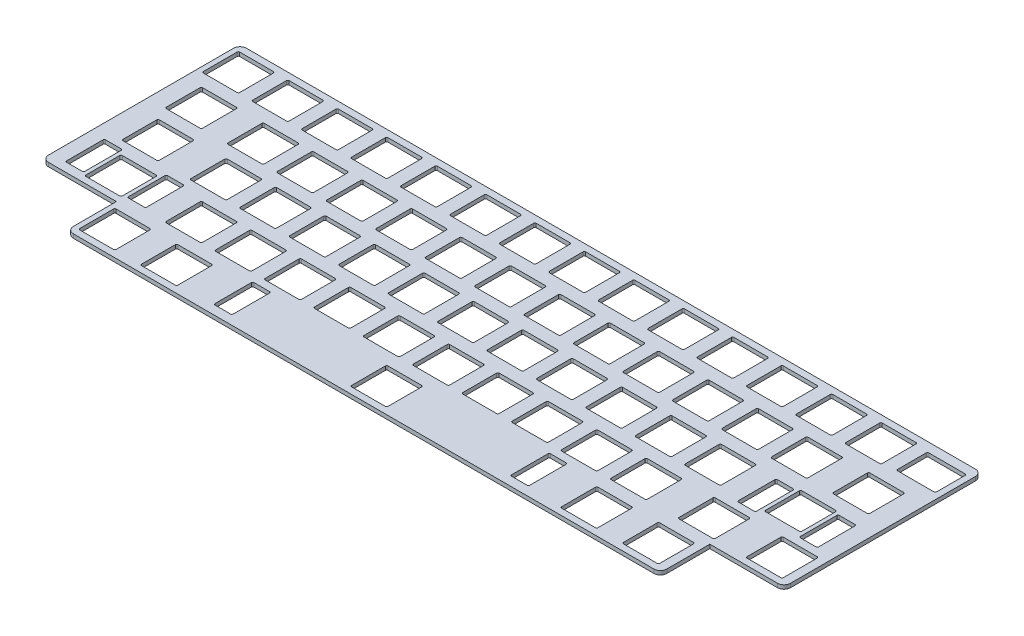
from build123d import *

# Parameters (mm, degrees)
BOSS_EXTRUDE1_DEPTH = 1.5
FILLET1_R           = 2.5


with BuildPart() as part:
    # Sketch1 → Boss-Extrude1 (new body)
    with BuildSketch(Plane(origin=(0, 0, 0), x_dir=(1, 0, 0), z_dir=(0, 1, 0))):
        Polygon((0.569553771, 0.054339834), (286.319553771, 0.054339834), (286.319553771, -76.145660166), (257.744553771, -76.145660166), (257.744553771, -95.195660166), (29.144553771, -95.195660166), (29.144553771, -76.145660166), (0.569553771, -76.145660166), align=None)
        with BuildLine():
            Line((3.023274247, -2.523559495), (16.015857787, -2.523559495))
            ThreePointArc((16.015857787, -2.523559495), (16.369209476, -2.669922557), (16.515572538, -3.023274247))
            Line((16.515572538, -3.023274247), (16.515572538, -16.015857787))
            ThreePointArc((16.515572538, -16.015857787), (16.369209476, -16.369209476), (16.015857787, -16.515572538))
            Line((16.015857787, -16.515572538), (3.023274247, -16.515572538))
            ThreePointArc((3.023274247, -16.515572538), (2.669922557, -16.369209476), (2.523559495, -16.015857787))
            Line((2.523559495, -16.015857787), (2.523559495, -3.023274247))
            ThreePointArc((2.523559495, -3.023274247), (2.669922557, -2.669922557), (3.023274247, -2.523559495))
        make_face(mode=Mode.SUBTRACT)
        with BuildLine():
            Line((22.06240628, -2.523559495), (35.05498982, -2.523559495))
            ThreePointArc((35.05498982, -2.523559495), (35.408341509, -2.669922557), (35.554704571, -3.023274247))
            Line((35.554704571, -3.023274247), (35.554704571, -16.015857787))
            ThreePointArc((35.554704571, -16.015857787), (35.408341509, -16.369209476), (35.05498982, -16.515572538))
            Line((35.05498982, -16.515572538), (22.06240628, -16.515572538))
            ThreePointArc((22.06240628, -16.515572538), (21.709054591, -16.369209476), (21.562691529, -16.015857787))
            Line((21.562691529, -16.015857787), (21.562691529, -3.023274247))
            ThreePointArc((21.562691529, -3.023274247), (21.709054591, -2.669922557), (22.06240628, -2.523559495))
        make_face(mode=Mode.SUBTRACT)
        with BuildLine():
            Line((41.101538313, -2.523559495), (54.094121853, -2.523559495))
            ThreePointArc((54.094121853, -2.523559495), (54.447473543, -2.669922557), (54.593836605, -3.023274247))
            Line((54.593836605, -3.023274247), (54.593836605, -16.015857787))
            ThreePointArc((54.593836605, -16.015857787), (54.447473543, -16.369209476), (54.094121853, -16.515572538))
            Line((54.094121853, -16.515572538), (41.101538313, -16.515572538))
            ThreePointArc((41.101538313, -16.515572538), (40.748186624, -16.369209476), (40.601823562, -16.015857787))
            Line((40.601823562, -16.015857787), (40.601823562, -3.023274247))
            ThreePointArc((40.601823562, -3.023274247), (40.748186624, -2.669922557), (41.101538313, -2.523559495))
        make_face(mode=Mode.SUBTRACT)
        with BuildLine():
            Line((60.140670347, -2.523559495), (73.133253886, -2.523559495))
            ThreePointArc((73.133253886, -2.523559495), (73.486605576, -2.669922557), (73.632968638, -3.023274247))
            Line((73.632968638, -3.023274247), (73.632968638, -16.015857787))
            ThreePointArc((73.632968638, -16.015857787), (73.486605576, -16.369209476), (73.133253886, -16.515572538))
            Line((73.133253886, -16.515572538), (60.140670347, -16.515572538))
            ThreePointArc((60.140670347, -16.515572538), (59.787318657, -16.369209476), (59.640955595, -16.015857787))
            Line((59.640955595, -16.015857787), (59.640955595, -3.023274247))
            ThreePointArc((59.640955595, -3.023274247), (59.787318657, -2.669922557), (60.140670347, -2.523559495))
        make_face(mode=Mode.SUBTRACT)
        with BuildLine():
            Line((79.17980238, -2.523559495), (92.17238592, -2.523559495))
            ThreePointArc((92.17238592, -2.523559495), (92.525737609, -2.669922557), (92.672100671, -3.023274247))
            Line((92.672100671, -3.023274247), (92.672100671, -16.015857787))
            ThreePointArc((92.672100671, -16.015857787), (92.525737609, -16.369209476), (92.17238592, -16.515572538))
            Line((92.17238592, -16.515572538), (79.17980238, -16.515572538))
            ThreePointArc((79.17980238, -16.515572538), (78.82645069, -16.369209476), (78.680087628, -16.015857787))
            Line((78.680087628, -16.015857787), (78.680087628, -3.023274247))
            ThreePointArc((78.680087628, -3.023274247), (78.82645069, -2.669922557), (79.17980238, -2.523559495))
        make_face(mode=Mode.SUBTRACT)
        with BuildLine():
            Line((98.218934413, -2.523559495), (111.211517953, -2.523559495))
            ThreePointArc((111.211517953, -2.523559495), (111.564869642, -2.669922557), (111.711232704, -3.023274247))
            Line((111.711232704, -3.023274247), (111.711232704, -16.015857787))
            ThreePointArc((111.711232704, -16.015857787), (111.564869642, -16.369209476), (111.211517953, -16.515572538))
            Line((111.211517953, -16.515572538), (98.218934413, -16.515572538))
            ThreePointArc((98.218934413, -16.515572538), (97.865582724, -16.369209476), (97.719219662, -16.015857787))
            Line((97.719219662, -16.015857787), (97.719219662, -3.023274247))
            ThreePointArc((97.719219662, -3.023274247), (97.865582724, -2.669922557), (98.218934413, -2.523559495))
        make_face(mode=Mode.SUBTRACT)
        with BuildLine():
            Line((117.258066446, -2.523559495), (130.250649986, -2.523559495))
            ThreePointArc((130.250649986, -2.523559495), (130.604001676, -2.669922557), (130.750364738, -3.023274247))
            Line((130.750364738, -3.023274247), (130.750364738, -16.015857787))
            ThreePointArc((130.750364738, -16.015857787), (130.604001676, -16.369209476), (130.250649986, -16.515572538))
            Line((130.250649986, -16.515572538), (117.258066446, -16.515572538))
            ThreePointArc((117.258066446, -16.515572538), (116.904714757, -16.369209476), (116.758351695, -16.015857787))
            Line((116.758351695, -16.015857787), (116.758351695, -3.023274247))
            ThreePointArc((116.758351695, -3.023274247), (116.904714757, -2.669922557), (117.258066446, -2.523559495))
        make_face(mode=Mode.SUBTRACT)
        with BuildLine():
            Line((136.29719848, -2.523559495), (149.28978202, -2.523559495))
            ThreePointArc((149.28978202, -2.523559495), (149.643133709, -2.669922557), (149.789496771, -3.023274247))
            Line((149.789496771, -3.023274247), (149.789496771, -16.015857787))
            ThreePointArc((149.789496771, -16.015857787), (149.643133709, -16.369209476), (149.28978202, -16.515572538))
            Line((149.28978202, -16.515572538), (136.29719848, -16.515572538))
            ThreePointArc((136.29719848, -16.515572538), (135.94384679, -16.369209476), (135.797483728, -16.015857787))
            Line((135.797483728, -16.015857787), (135.797483728, -3.023274247))
            ThreePointArc((135.797483728, -3.023274247), (135.94384679, -2.669922557), (136.29719848, -2.523559495))
        make_face(mode=Mode.SUBTRACT)
        with BuildLine():
            Line((155.336330513, -2.523559495), (168.328914053, -2.523559495))
            ThreePointArc((168.328914053, -2.523559495), (168.682265742, -2.669922557), (168.828628804, -3.023274247))
            Line((168.828628804, -3.023274247), (168.828628804, -16.015857787))
            ThreePointArc((168.828628804, -16.015857787), (168.682265742, -16.369209476), (168.328914053, -16.515572538))
            Line((168.328914053, -16.515572538), (155.336330513, -16.515572538))
            ThreePointArc((155.336330513, -16.515572538), (154.982978824, -16.369209476), (154.836615762, -16.015857787))
            Line((154.836615762, -16.015857787), (154.836615762, -3.023274247))
            ThreePointArc((154.836615762, -3.023274247), (154.982978824, -2.669922557), (155.336330513, -2.523559495))
        make_face(mode=Mode.SUBTRACT)
        with BuildLine():
            Line((174.375462546, -2.523559495), (187.368046086, -2.523559495))
            ThreePointArc((187.368046086, -2.523559495), (187.721397776, -2.669922557), (187.867760838, -3.023274247))
            Line((187.867760838, -3.023274247), (187.867760838, -16.015857787))
            ThreePointArc((187.867760838, -16.015857787), (187.721397776, -16.369209476), (187.368046086, -16.515572538))
            Line((187.368046086, -16.515572538), (174.375462546, -16.515572538))
            ThreePointArc((174.375462546, -16.515572538), (174.022110857, -16.369209476), (173.875747795, -16.015857787))
            Line((173.875747795, -16.015857787), (173.875747795, -3.023274247))
            ThreePointArc((173.875747795, -3.023274247), (174.022110857, -2.669922557), (174.375462546, -2.523559495))
        make_face(mode=Mode.SUBTRACT)
        with BuildLine():
            Line((193.41459458, -2.523559495), (206.407178119, -2.523559495))
            ThreePointArc((206.407178119, -2.523559495), (206.760529809, -2.669922557), (206.906892871, -3.023274247))
            Line((206.906892871, -3.023274247), (206.906892871, -16.015857787))
            ThreePointArc((206.906892871, -16.015857787), (206.760529809, -16.369209476), (206.407178119, -16.515572538))
            Line((206.407178119, -16.515572538), (193.41459458, -16.515572538))
            ThreePointArc((193.41459458, -16.515572538), (193.06124289, -16.369209476), (192.914879828, -16.015857787))
            Line((192.914879828, -16.015857787), (192.914879828, -3.023274247))
            ThreePointArc((192.914879828, -3.023274247), (193.06124289, -2.669922557), (193.41459458, -2.523559495))
        make_face(mode=Mode.SUBTRACT)
        with BuildLine():
            Line((212.453726613, -2.523559495), (225.446310153, -2.523559495))
            ThreePointArc((225.446310153, -2.523559495), (225.799661842, -2.669922557), (225.946024904, -3.023274247))
            Line((225.946024904, -3.023274247), (225.946024904, -16.015857787))
            ThreePointArc((225.946024904, -16.015857787), (225.799661842, -16.369209476), (225.446310153, -16.515572538))
            Line((225.446310153, -16.515572538), (212.453726613, -16.515572538))
            ThreePointArc((212.453726613, -16.515572538), (212.100374923, -16.369209476), (211.954011861, -16.015857787))
            Line((211.954011861, -16.015857787), (211.954011861, -3.023274247))
            ThreePointArc((211.954011861, -3.023274247), (212.100374923, -2.669922557), (212.453726613, -2.523559495))
        make_face(mode=Mode.SUBTRACT)
        with BuildLine():
            Line((231.492858646, -2.523559495), (244.485442186, -2.523559495))
            ThreePointArc((244.485442186, -2.523559495), (244.838793875, -2.669922557), (244.985156937, -3.023274247))
            Line((244.985156937, -3.023274247), (244.985156937, -16.015857787))
            ThreePointArc((244.985156937, -16.015857787), (244.838793875, -16.369209476), (244.485442186, -16.515572538))
            Line((244.485442186, -16.515572538), (231.492858646, -16.515572538))
            ThreePointArc((231.492858646, -16.515572538), (231.139506957, -16.369209476), (230.993143895, -16.015857787))
            Line((230.993143895, -16.015857787), (230.993143895, -3.023274247))
            ThreePointArc((230.993143895, -3.023274247), (231.139506957, -2.669922557), (231.492858646, -2.523559495))
        make_face(mode=Mode.SUBTRACT)
        with BuildLine():
            Line((250.531990679, -2.523559495), (263.524574219, -2.523559495))
            ThreePointArc((263.524574219, -2.523559495), (263.877925909, -2.669922557), (264.024288971, -3.023274247))
            Line((264.024288971, -3.023274247), (264.024288971, -16.015857787))
            ThreePointArc((264.024288971, -16.015857787), (263.877925909, -16.369209476), (263.524574219, -16.515572538))
            Line((263.524574219, -16.515572538), (250.531990679, -16.515572538))
            ThreePointArc((250.531990679, -16.515572538), (250.17863899, -16.369209476), (250.032275928, -16.015857787))
            Line((250.032275928, -16.015857787), (250.032275928, -3.023274247))
            ThreePointArc((250.032275928, -3.023274247), (250.17863899, -2.669922557), (250.531990679, -2.523559495))
        make_face(mode=Mode.SUBTRACT)
        with BuildLine():
            Line((7.783057255, -21.562691529), (20.775640795, -21.562691529))
            ThreePointArc((20.775640795, -21.562691529), (21.128992484, -21.709054591), (21.275355546, -22.06240628))
            Line((21.275355546, -22.06240628), (21.275355546, -35.05498982))
            ThreePointArc((21.275355546, -35.05498982), (21.128992484, -35.408341509), (20.775640795, -35.554704571))
            Line((20.775640795, -35.554704571), (7.783057255, -35.554704571))
            ThreePointArc((7.783057255, -35.554704571), (7.429705566, -35.408341509), (7.283342504, -35.05498982))
            Line((7.283342504, -35.05498982), (7.283342504, -22.06240628))
            ThreePointArc((7.283342504, -22.06240628), (7.429705566, -21.709054591), (7.783057255, -21.562691529))
        make_face(mode=Mode.SUBTRACT)
        with BuildLine():
            Line((31.581972297, -21.562691529), (44.574555836, -21.562691529))
            ThreePointArc((44.574555836, -21.562691529), (44.927907526, -21.709054591), (45.074270588, -22.06240628))
            Line((45.074270588, -22.06240628), (45.074270588, -35.05498982))
            ThreePointArc((45.074270588, -35.05498982), (44.927907526, -35.408341509), (44.574555836, -35.554704571))
            Line((44.574555836, -35.554704571), (31.581972297, -35.554704571))
            ThreePointArc((31.581972297, -35.554704571), (31.228620607, -35.408341509), (31.082257545, -35.05498982))
            Line((31.082257545, -35.05498982), (31.082257545, -22.06240628))
            ThreePointArc((31.082257545, -22.06240628), (31.228620607, -21.709054591), (31.581972297, -21.562691529))
        make_face(mode=Mode.SUBTRACT)
        with BuildLine():
            Line((50.62110433, -21.562691529), (63.61368787, -21.562691529))
            ThreePointArc((63.61368787, -21.562691529), (63.967039559, -21.709054591), (64.113402621, -22.06240628))
            Line((64.113402621, -22.06240628), (64.113402621, -35.05498982))
            ThreePointArc((64.113402621, -35.05498982), (63.967039559, -35.408341509), (63.61368787, -35.554704571))
            Line((63.61368787, -35.554704571), (50.62110433, -35.554704571))
            ThreePointArc((50.62110433, -35.554704571), (50.267752641, -35.408341509), (50.121389578, -35.05498982))
            Line((50.121389578, -35.05498982), (50.121389578, -22.06240628))
            ThreePointArc((50.121389578, -22.06240628), (50.267752641, -21.709054591), (50.62110433, -21.562691529))
        make_face(mode=Mode.SUBTRACT)
        with BuildLine():
            Line((69.660236363, -21.562691529), (82.652819903, -21.562691529))
            ThreePointArc((82.652819903, -21.562691529), (83.006171592, -21.709054591), (83.152534655, -22.06240628))
            Line((83.152534655, -22.06240628), (83.152534655, -35.05498982))
            ThreePointArc((83.152534655, -35.05498982), (83.006171592, -35.408341509), (82.652819903, -35.554704571))
            Line((82.652819903, -35.554704571), (69.660236363, -35.554704571))
            ThreePointArc((69.660236363, -35.554704571), (69.306884674, -35.408341509), (69.160521612, -35.05498982))
            Line((69.160521612, -35.05498982), (69.160521612, -22.06240628))
            ThreePointArc((69.160521612, -22.06240628), (69.306884674, -21.709054591), (69.660236363, -21.562691529))
        make_face(mode=Mode.SUBTRACT)
        with BuildLine():
            Line((88.699368397, -21.562691529), (101.691951936, -21.562691529))
            ThreePointArc((101.691951936, -21.562691529), (102.045303626, -21.709054591), (102.191666688, -22.06240628))
            Line((102.191666688, -22.06240628), (102.191666688, -35.05498982))
            ThreePointArc((102.191666688, -35.05498982), (102.045303626, -35.408341509), (101.691951936, -35.554704571))
            Line((101.691951936, -35.554704571), (88.699368397, -35.554704571))
            ThreePointArc((88.699368397, -35.554704571), (88.346016707, -35.408341509), (88.199653645, -35.05498982))
            Line((88.199653645, -35.05498982), (88.199653645, -22.06240628))
            ThreePointArc((88.199653645, -22.06240628), (88.346016707, -21.709054591), (88.699368397, -21.562691529))
        make_face(mode=Mode.SUBTRACT)
        with BuildLine():
            Line((107.73850043, -21.562691529), (120.73108397, -21.562691529))
            ThreePointArc((120.73108397, -21.562691529), (121.084435659, -21.709054591), (121.230798721, -22.06240628))
            Line((121.230798721, -22.06240628), (121.230798721, -35.05498982))
            ThreePointArc((121.230798721, -35.05498982), (121.084435659, -35.408341509), (120.73108397, -35.554704571))
            Line((120.73108397, -35.554704571), (107.73850043, -35.554704571))
            ThreePointArc((107.73850043, -35.554704571), (107.38514874, -35.408341509), (107.238785678, -35.05498982))
            Line((107.238785678, -35.05498982), (107.238785678, -22.06240628))
            ThreePointArc((107.238785678, -22.06240628), (107.38514874, -21.709054591), (107.73850043, -21.562691529))
        make_face(mode=Mode.SUBTRACT)
        with BuildLine():
            Line((126.777632463, -21.562691529), (139.770216003, -21.562691529))
            ThreePointArc((139.770216003, -21.562691529), (140.123567692, -21.709054591), (140.269930754, -22.06240628))
            Line((140.269930754, -22.06240628), (140.269930754, -35.05498982))
            ThreePointArc((140.269930754, -35.05498982), (140.123567692, -35.408341509), (139.770216003, -35.554704571))
            Line((139.770216003, -35.554704571), (126.777632463, -35.554704571))
            ThreePointArc((126.777632463, -35.554704571), (126.424280774, -35.408341509), (126.277917712, -35.05498982))
            Line((126.277917712, -35.05498982), (126.277917712, -22.06240628))
            ThreePointArc((126.277917712, -22.06240628), (126.424280774, -21.709054591), (126.777632463, -21.562691529))
        make_face(mode=Mode.SUBTRACT)
        with BuildLine():
            Line((145.816764496, -21.562691529), (158.809348036, -21.562691529))
            ThreePointArc((158.809348036, -21.562691529), (159.162699726, -21.709054591), (159.309062788, -22.06240628))
            Line((159.309062788, -22.06240628), (159.309062788, -35.05498982))
            ThreePointArc((159.309062788, -35.05498982), (159.162699726, -35.408341509), (158.809348036, -35.554704571))
            Line((158.809348036, -35.554704571), (145.816764496, -35.554704571))
            ThreePointArc((145.816764496, -35.554704571), (145.463412807, -35.408341509), (145.317049745, -35.05498982))
            Line((145.317049745, -35.05498982), (145.317049745, -22.06240628))
            ThreePointArc((145.317049745, -22.06240628), (145.463412807, -21.709054591), (145.816764496, -21.562691529))
        make_face(mode=Mode.SUBTRACT)
        with BuildLine():
            Line((164.85589653, -21.562691529), (177.848480069, -21.562691529))
            ThreePointArc((177.848480069, -21.562691529), (178.201831759, -21.709054591), (178.348194821, -22.06240628))
            Line((178.348194821, -22.06240628), (178.348194821, -35.05498982))
            ThreePointArc((178.348194821, -35.05498982), (178.201831759, -35.408341509), (177.848480069, -35.554704571))
            Line((177.848480069, -35.554704571), (164.85589653, -35.554704571))
            ThreePointArc((164.85589653, -35.554704571), (164.50254484, -35.408341509), (164.356181778, -35.05498982))
            Line((164.356181778, -35.05498982), (164.356181778, -22.06240628))
            ThreePointArc((164.356181778, -22.06240628), (164.50254484, -21.709054591), (164.85589653, -21.562691529))
        make_face(mode=Mode.SUBTRACT)
        with BuildLine():
            Line((183.895028563, -21.562691529), (196.887612103, -21.562691529))
            ThreePointArc((196.887612103, -21.562691529), (197.240963792, -21.709054591), (197.387326854, -22.06240628))
            Line((197.387326854, -22.06240628), (197.387326854, -35.05498982))
            ThreePointArc((197.387326854, -35.05498982), (197.240963792, -35.408341509), (196.887612103, -35.554704571))
            Line((196.887612103, -35.554704571), (183.895028563, -35.554704571))
            ThreePointArc((183.895028563, -35.554704571), (183.541676874, -35.408341509), (183.395313811, -35.05498982))
            Line((183.395313811, -35.05498982), (183.395313811, -22.06240628))
            ThreePointArc((183.395313811, -22.06240628), (183.541676874, -21.709054591), (183.895028563, -21.562691529))
        make_face(mode=Mode.SUBTRACT)
        with BuildLine():
            Line((202.934160596, -21.562691529), (215.926744136, -21.562691529))
            ThreePointArc((215.926744136, -21.562691529), (216.280095825, -21.709054591), (216.426458888, -22.06240628))
            Line((216.426458888, -22.06240628), (216.426458888, -35.05498982))
            ThreePointArc((216.426458888, -35.05498982), (216.280095825, -35.408341509), (215.926744136, -35.554704571))
            Line((215.926744136, -35.554704571), (202.934160596, -35.554704571))
            ThreePointArc((202.934160596, -35.554704571), (202.580808907, -35.408341509), (202.434445845, -35.05498982))
            Line((202.434445845, -35.05498982), (202.434445845, -22.06240628))
            ThreePointArc((202.434445845, -22.06240628), (202.580808907, -21.709054591), (202.934160596, -21.562691529))
        make_face(mode=Mode.SUBTRACT)
        with BuildLine():
            Line((221.97329263, -21.562691529), (234.965876169, -21.562691529))
            ThreePointArc((234.965876169, -21.562691529), (235.319227859, -21.709054591), (235.465590921, -22.06240628))
            Line((235.465590921, -22.06240628), (235.465590921, -35.05498982))
            ThreePointArc((235.465590921, -35.05498982), (235.319227859, -35.408341509), (234.965876169, -35.554704571))
            Line((234.965876169, -35.554704571), (221.97329263, -35.554704571))
            ThreePointArc((221.97329263, -35.554704571), (221.61994094, -35.408341509), (221.473577878, -35.05498982))
            Line((221.473577878, -35.05498982), (221.473577878, -22.06240628))
            ThreePointArc((221.473577878, -22.06240628), (221.61994094, -21.709054591), (221.97329263, -21.562691529))
        make_face(mode=Mode.SUBTRACT)
        with BuildLine():
            Line((241.012424663, -21.562691529), (254.005008203, -21.562691529))
            ThreePointArc((254.005008203, -21.562691529), (254.358359892, -21.709054591), (254.504722954, -22.06240628))
            Line((254.504722954, -22.06240628), (254.504722954, -35.05498982))
            ThreePointArc((254.504722954, -35.05498982), (254.358359892, -35.408341509), (254.005008203, -35.554704571))
            Line((254.005008203, -35.554704571), (241.012424663, -35.554704571))
            ThreePointArc((241.012424663, -35.554704571), (240.659072973, -35.408341509), (240.512709911, -35.05498982))
            Line((240.512709911, -35.05498982), (240.512709911, -22.06240628))
            ThreePointArc((240.512709911, -22.06240628), (240.659072973, -21.709054591), (241.012424663, -21.562691529))
        make_face(mode=Mode.SUBTRACT)
        with BuildLine():
            Line((264.811339704, -21.562691529), (277.803923244, -21.562691529))
            ThreePointArc((277.803923244, -21.562691529), (278.157274934, -21.709054591), (278.303637996, -22.06240628))
            Line((278.303637996, -22.06240628), (278.303637996, -35.05498982))
            ThreePointArc((278.303637996, -35.05498982), (278.157274934, -35.408341509), (277.803923244, -35.554704571))
            Line((277.803923244, -35.554704571), (264.811339704, -35.554704571))
            ThreePointArc((264.811339704, -35.554704571), (264.457988015, -35.408341509), (264.311624953, -35.05498982))
            Line((264.311624953, -35.05498982), (264.311624953, -22.06240628))
            ThreePointArc((264.311624953, -22.06240628), (264.457988015, -21.709054591), (264.811339704, -21.562691529))
        make_face(mode=Mode.SUBTRACT)
        with BuildLine():
            Line((10.162948759, -40.601823562), (23.155532299, -40.601823562))
            ThreePointArc((23.155532299, -40.601823562), (23.508883988, -40.748186624), (23.655247051, -41.101538313))
            Line((23.655247051, -41.101538313), (23.655247051, -54.094121853))
            ThreePointArc((23.655247051, -54.094121853), (23.508883988, -54.447473543), (23.155532299, -54.593836605))
            Line((23.155532299, -54.593836605), (10.162948759, -54.593836605))
            ThreePointArc((10.162948759, -54.593836605), (9.80959707, -54.447473543), (9.663234008, -54.094121853))
            Line((9.663234008, -54.094121853), (9.663234008, -41.101538313))
            ThreePointArc((9.663234008, -41.101538313), (9.80959707, -40.748186624), (10.162948759, -40.601823562))
        make_face(mode=Mode.SUBTRACT)
        with BuildLine():
            Line((36.341755305, -40.601823562), (49.334338845, -40.601823562))
            ThreePointArc((49.334338845, -40.601823562), (49.687690534, -40.748186624), (49.834053596, -41.101538313))
            Line((49.834053596, -41.101538313), (49.834053596, -54.094121853))
            ThreePointArc((49.834053596, -54.094121853), (49.687690534, -54.447473543), (49.334338845, -54.593836605))
            Line((49.334338845, -54.593836605), (36.341755305, -54.593836605))
            ThreePointArc((36.341755305, -54.593836605), (35.988403616, -54.447473543), (35.842040553, -54.094121853))
            Line((35.842040553, -54.094121853), (35.842040553, -41.101538313))
            ThreePointArc((35.842040553, -41.101538313), (35.988403616, -40.748186624), (36.341755305, -40.601823562))
        make_face(mode=Mode.SUBTRACT)
        with BuildLine():
            Line((55.380887338, -40.601823562), (68.373470878, -40.601823562))
            ThreePointArc((68.373470878, -40.601823562), (68.726822568, -40.748186624), (68.87318563, -41.101538313))
            Line((68.87318563, -41.101538313), (68.87318563, -54.094121853))
            ThreePointArc((68.87318563, -54.094121853), (68.726822568, -54.447473543), (68.373470878, -54.593836605))
            Line((68.373470878, -54.593836605), (55.380887338, -54.593836605))
            ThreePointArc((55.380887338, -54.593836605), (55.027535649, -54.447473543), (54.881172587, -54.094121853))
            Line((54.881172587, -54.094121853), (54.881172587, -41.101538313))
            ThreePointArc((54.881172587, -41.101538313), (55.027535649, -40.748186624), (55.380887338, -40.601823562))
        make_face(mode=Mode.SUBTRACT)
        with BuildLine():
            Line((74.420019372, -40.601823562), (87.412602911, -40.601823562))
            ThreePointArc((87.412602911, -40.601823562), (87.765954601, -40.748186624), (87.912317663, -41.101538313))
            Line((87.912317663, -41.101538313), (87.912317663, -54.094121853))
            ThreePointArc((87.912317663, -54.094121853), (87.765954601, -54.447473543), (87.412602911, -54.593836605))
            Line((87.412602911, -54.593836605), (74.420019372, -54.593836605))
            ThreePointArc((74.420019372, -54.593836605), (74.066667682, -54.447473543), (73.92030462, -54.094121853))
            Line((73.92030462, -54.094121853), (73.92030462, -41.101538313))
            ThreePointArc((73.92030462, -41.101538313), (74.066667682, -40.748186624), (74.420019372, -40.601823562))
        make_face(mode=Mode.SUBTRACT)
        with BuildLine():
            Line((93.459151405, -40.601823562), (106.451734945, -40.601823562))
            ThreePointArc((106.451734945, -40.601823562), (106.805086634, -40.748186624), (106.951449696, -41.101538313))
            Line((106.951449696, -41.101538313), (106.951449696, -54.094121853))
            ThreePointArc((106.951449696, -54.094121853), (106.805086634, -54.447473543), (106.451734945, -54.593836605))
            Line((106.451734945, -54.593836605), (93.459151405, -54.593836605))
            ThreePointArc((93.459151405, -54.593836605), (93.105799715, -54.447473543), (92.959436653, -54.094121853))
            Line((92.959436653, -54.094121853), (92.959436653, -41.101538313))
            ThreePointArc((92.959436653, -41.101538313), (93.105799715, -40.748186624), (93.459151405, -40.601823562))
        make_face(mode=Mode.SUBTRACT)
        with BuildLine():
            Line((112.498283438, -40.601823562), (125.490866978, -40.601823562))
            ThreePointArc((125.490866978, -40.601823562), (125.844218667, -40.748186624), (125.990581729, -41.101538313))
            Line((125.990581729, -41.101538313), (125.990581729, -54.094121853))
            ThreePointArc((125.990581729, -54.094121853), (125.844218667, -54.447473543), (125.490866978, -54.593836605))
            Line((125.490866978, -54.593836605), (112.498283438, -54.593836605))
            ThreePointArc((112.498283438, -54.593836605), (112.144931749, -54.447473543), (111.998568687, -54.094121853))
            Line((111.998568687, -54.094121853), (111.998568687, -41.101538313))
            ThreePointArc((111.998568687, -41.101538313), (112.144931749, -40.748186624), (112.498283438, -40.601823562))
        make_face(mode=Mode.SUBTRACT)
        with BuildLine():
            Line((131.537415471, -40.601823562), (144.529999011, -40.601823562))
            ThreePointArc((144.529999011, -40.601823562), (144.883350701, -40.748186624), (145.029713763, -41.101538313))
            Line((145.029713763, -41.101538313), (145.029713763, -54.094121853))
            ThreePointArc((145.029713763, -54.094121853), (144.883350701, -54.447473543), (144.529999011, -54.593836605))
            Line((144.529999011, -54.593836605), (131.537415471, -54.593836605))
            ThreePointArc((131.537415471, -54.593836605), (131.184063782, -54.447473543), (131.03770072, -54.094121853))
            Line((131.03770072, -54.094121853), (131.03770072, -41.101538313))
            ThreePointArc((131.03770072, -41.101538313), (131.184063782, -40.748186624), (131.537415471, -40.601823562))
        make_face(mode=Mode.SUBTRACT)
        with BuildLine():
            Line((150.576547505, -40.601823562), (163.569131044, -40.601823562))
            ThreePointArc((163.569131044, -40.601823562), (163.922482734, -40.748186624), (164.068845796, -41.101538313))
            Line((164.068845796, -41.101538313), (164.068845796, -54.094121853))
            ThreePointArc((164.068845796, -54.094121853), (163.922482734, -54.447473543), (163.569131044, -54.593836605))
            Line((163.569131044, -54.593836605), (150.576547505, -54.593836605))
            ThreePointArc((150.576547505, -54.593836605), (150.223195815, -54.447473543), (150.076832753, -54.094121853))
            Line((150.076832753, -54.094121853), (150.076832753, -41.101538313))
            ThreePointArc((150.076832753, -41.101538313), (150.223195815, -40.748186624), (150.576547505, -40.601823562))
        make_face(mode=Mode.SUBTRACT)
        with BuildLine():
            Line((169.615679538, -40.601823562), (182.608263078, -40.601823562))
            ThreePointArc((182.608263078, -40.601823562), (182.961614767, -40.748186624), (183.107977829, -41.101538313))
            Line((183.107977829, -41.101538313), (183.107977829, -54.094121853))
            ThreePointArc((183.107977829, -54.094121853), (182.961614767, -54.447473543), (182.608263078, -54.593836605))
            Line((182.608263078, -54.593836605), (169.615679538, -54.593836605))
            ThreePointArc((169.615679538, -54.593836605), (169.262327849, -54.447473543), (169.115964786, -54.094121853))
            Line((169.115964786, -54.094121853), (169.115964786, -41.101538313))
            ThreePointArc((169.115964786, -41.101538313), (169.262327849, -40.748186624), (169.615679538, -40.601823562))
        make_face(mode=Mode.SUBTRACT)
        with BuildLine():
            Line((188.654811571, -40.601823562), (201.647395111, -40.601823562))
            ThreePointArc((201.647395111, -40.601823562), (202.000746801, -40.748186624), (202.147109863, -41.101538313))
            Line((202.147109863, -41.101538313), (202.147109863, -54.094121853))
            ThreePointArc((202.147109863, -54.094121853), (202.000746801, -54.447473543), (201.647395111, -54.593836605))
            Line((201.647395111, -54.593836605), (188.654811571, -54.593836605))
            ThreePointArc((188.654811571, -54.593836605), (188.301459882, -54.447473543), (188.15509682, -54.094121853))
            Line((188.15509682, -54.094121853), (188.15509682, -41.101538313))
            ThreePointArc((188.15509682, -41.101538313), (188.301459882, -40.748186624), (188.654811571, -40.601823562))
        make_face(mode=Mode.SUBTRACT)
        with BuildLine():
            Line((207.693943605, -40.601823562), (220.686527144, -40.601823562))
            ThreePointArc((220.686527144, -40.601823562), (221.039878834, -40.748186624), (221.186241896, -41.101538313))
            Line((221.186241896, -41.101538313), (221.186241896, -54.094121853))
            ThreePointArc((221.186241896, -54.094121853), (221.039878834, -54.447473543), (220.686527144, -54.593836605))
            Line((220.686527144, -54.593836605), (207.693943605, -54.593836605))
            ThreePointArc((207.693943605, -54.593836605), (207.340591915, -54.447473543), (207.194228853, -54.094121853))
            Line((207.194228853, -54.094121853), (207.194228853, -41.101538313))
            ThreePointArc((207.194228853, -41.101538313), (207.340591915, -40.748186624), (207.693943605, -40.601823562))
        make_face(mode=Mode.SUBTRACT)
        with BuildLine():
            Line((226.733075638, -40.601823562), (239.725659178, -40.601823562))
            ThreePointArc((239.725659178, -40.601823562), (240.079010867, -40.748186624), (240.225373929, -41.101538313))
            Line((240.225373929, -41.101538313), (240.225373929, -54.094121853))
            ThreePointArc((240.225373929, -54.094121853), (240.079010867, -54.447473543), (239.725659178, -54.593836605))
            Line((239.725659178, -54.593836605), (226.733075638, -54.593836605))
            ThreePointArc((226.733075638, -54.593836605), (226.379723948, -54.447473543), (226.233360886, -54.094121853))
            Line((226.233360886, -54.094121853), (226.233360886, -41.101538313))
            ThreePointArc((226.233360886, -41.101538313), (226.379723948, -40.748186624), (226.733075638, -40.601823562))
        make_face(mode=Mode.SUBTRACT)
        with BuildLine():
            Line((257.671665192, -40.601823562), (270.664248732, -40.601823562))
            ThreePointArc((270.664248732, -40.601823562), (271.017600421, -40.748186624), (271.163963483, -41.101538313))
            Line((271.163963483, -41.101538313), (271.163963483, -54.094121853))
            ThreePointArc((271.163963483, -54.094121853), (271.017600421, -54.447473543), (270.664248732, -54.593836605))
            Line((270.664248732, -54.593836605), (257.671665192, -54.593836605))
            ThreePointArc((257.671665192, -54.593836605), (257.318313502, -54.447473543), (257.17195044, -54.094121853))
            Line((257.17195044, -54.094121853), (257.17195044, -41.101538313))
            ThreePointArc((257.17195044, -41.101538313), (257.318313502, -40.748186624), (257.671665192, -40.601823562))
        make_face(mode=Mode.SUBTRACT)
        with BuildLine():
            Line((249.238479045, -41.601253065), (255.235056063, -41.601253065))
            ThreePointArc((255.235056063, -41.601253065), (255.588407753, -41.747616127), (255.734770815, -42.100967816))
            Line((255.734770815, -42.100967816), (255.734770815, -56.092980859))
            ThreePointArc((255.734770815, -56.092980859), (255.588407753, -56.446332549), (255.235056063, -56.592695611))
            Line((255.235056063, -56.592695611), (249.238479045, -56.592695611))
            ThreePointArc((249.238479045, -56.592695611), (248.885127356, -56.446332549), (248.738764294, -56.092980859))
            Line((248.738764294, -56.092980859), (248.738764294, -42.100967816))
            ThreePointArc((248.738764294, -42.100967816), (248.885127356, -41.747616127), (249.238479045, -41.601253065))
        make_face(mode=Mode.SUBTRACT)
        with BuildLine():
            Line((273.10085786, -41.601253065), (279.097434879, -41.601253065))
            ThreePointArc((279.097434879, -41.601253065), (279.450786568, -41.747616127), (279.59714963, -42.100967816))
            Line((279.59714963, -42.100967816), (279.59714963, -56.092980859))
            ThreePointArc((279.59714963, -56.092980859), (279.450786568, -56.446332549), (279.097434879, -56.592695611))
            Line((279.097434879, -56.592695611), (273.10085786, -56.592695611))
            ThreePointArc((273.10085786, -56.592695611), (272.747506171, -56.446332549), (272.601143109, -56.092980859))
            Line((272.601143109, -56.092980859), (272.601143109, -42.100967816))
            ThreePointArc((272.601143109, -42.100967816), (272.747506171, -41.747616127), (273.10085786, -41.601253065))
        make_face(mode=Mode.SUBTRACT)
        with BuildLine():
            Line((45.861321322, -59.640955595), (58.853904861, -59.640955595))
            ThreePointArc((58.853904861, -59.640955595), (59.207256551, -59.787318657), (59.353619613, -60.140670347))
            Line((59.353619613, -60.140670347), (59.353619613, -73.133253886))
            ThreePointArc((59.353619613, -73.133253886), (59.207256551, -73.486605576), (58.853904861, -73.632968638))
            Line((58.853904861, -73.632968638), (45.861321322, -73.632968638))
            ThreePointArc((45.861321322, -73.632968638), (45.507969632, -73.486605576), (45.36160657, -73.133253886))
            Line((45.36160657, -73.133253886), (45.36160657, -60.140670347))
            ThreePointArc((45.36160657, -60.140670347), (45.507969632, -59.787318657), (45.861321322, -59.640955595))
        make_face(mode=Mode.SUBTRACT)
        with BuildLine():
            Line((64.900453355, -59.640955595), (77.893036895, -59.640955595))
            ThreePointArc((77.893036895, -59.640955595), (78.246388584, -59.787318657), (78.392751646, -60.140670347))
            Line((78.392751646, -60.140670347), (78.392751646, -73.133253886))
            ThreePointArc((78.392751646, -73.133253886), (78.246388584, -73.486605576), (77.893036895, -73.632968638))
            Line((77.893036895, -73.632968638), (64.900453355, -73.632968638))
            ThreePointArc((64.900453355, -73.632968638), (64.547101665, -73.486605576), (64.400738603, -73.133253886))
            Line((64.400738603, -73.133253886), (64.400738603, -60.140670347))
            ThreePointArc((64.400738603, -60.140670347), (64.547101665, -59.787318657), (64.900453355, -59.640955595))
        make_face(mode=Mode.SUBTRACT)
        with BuildLine():
            Line((83.939585388, -59.640955595), (96.932168928, -59.640955595))
            ThreePointArc((96.932168928, -59.640955595), (97.285520617, -59.787318657), (97.43188368, -60.140670347))
            Line((97.43188368, -60.140670347), (97.43188368, -73.133253886))
            ThreePointArc((97.43188368, -73.133253886), (97.285520617, -73.486605576), (96.932168928, -73.632968638))
            Line((96.932168928, -73.632968638), (83.939585388, -73.632968638))
            ThreePointArc((83.939585388, -73.632968638), (83.586233699, -73.486605576), (83.439870637, -73.133253886))
            Line((83.439870637, -73.133253886), (83.439870637, -60.140670347))
            ThreePointArc((83.439870637, -60.140670347), (83.586233699, -59.787318657), (83.939585388, -59.640955595))
        make_face(mode=Mode.SUBTRACT)
        with BuildLine():
            Line((102.978717422, -59.640955595), (115.971300961, -59.640955595))
            ThreePointArc((115.971300961, -59.640955595), (116.324652651, -59.787318657), (116.471015713, -60.140670347))
            Line((116.471015713, -60.140670347), (116.471015713, -73.133253886))
            ThreePointArc((116.471015713, -73.133253886), (116.324652651, -73.486605576), (115.971300961, -73.632968638))
            Line((115.971300961, -73.632968638), (102.978717422, -73.632968638))
            ThreePointArc((102.978717422, -73.632968638), (102.625365732, -73.486605576), (102.47900267, -73.133253886))
            Line((102.47900267, -73.133253886), (102.47900267, -60.140670347))
            ThreePointArc((102.47900267, -60.140670347), (102.625365732, -59.787318657), (102.978717422, -59.640955595))
        make_face(mode=Mode.SUBTRACT)
        with BuildLine():
            Line((122.017849455, -59.640955595), (135.010432995, -59.640955595))
            ThreePointArc((135.010432995, -59.640955595), (135.363784684, -59.787318657), (135.510147746, -60.140670347))
            Line((135.510147746, -60.140670347), (135.510147746, -73.133253886))
            ThreePointArc((135.510147746, -73.133253886), (135.363784684, -73.486605576), (135.010432995, -73.632968638))
            Line((135.010432995, -73.632968638), (122.017849455, -73.632968638))
            ThreePointArc((122.017849455, -73.632968638), (121.664497765, -73.486605576), (121.518134703, -73.133253886))
            Line((121.518134703, -73.133253886), (121.518134703, -60.140670347))
            ThreePointArc((121.518134703, -60.140670347), (121.664497765, -59.787318657), (122.017849455, -59.640955595))
        make_face(mode=Mode.SUBTRACT)
        with BuildLine():
            Line((141.056981488, -59.640955595), (154.049565028, -59.640955595))
            ThreePointArc((154.049565028, -59.640955595), (154.402916717, -59.787318657), (154.549279779, -60.140670347))
            Line((154.549279779, -60.140670347), (154.549279779, -73.133253886))
            ThreePointArc((154.549279779, -73.133253886), (154.402916717, -73.486605576), (154.049565028, -73.632968638))
            Line((154.049565028, -73.632968638), (141.056981488, -73.632968638))
            ThreePointArc((141.056981488, -73.632968638), (140.703629799, -73.486605576), (140.557266737, -73.133253886))
            Line((140.557266737, -73.133253886), (140.557266737, -60.140670347))
            ThreePointArc((140.557266737, -60.140670347), (140.703629799, -59.787318657), (141.056981488, -59.640955595))
        make_face(mode=Mode.SUBTRACT)
        with BuildLine():
            Line((160.096113521, -59.640955595), (173.088697061, -59.640955595))
            ThreePointArc((173.088697061, -59.640955595), (173.442048751, -59.787318657), (173.588411813, -60.140670347))
            Line((173.588411813, -60.140670347), (173.588411813, -73.133253886))
            ThreePointArc((173.588411813, -73.133253886), (173.442048751, -73.486605576), (173.088697061, -73.632968638))
            Line((173.088697061, -73.632968638), (160.096113521, -73.632968638))
            ThreePointArc((160.096113521, -73.632968638), (159.742761832, -73.486605576), (159.59639877, -73.133253886))
            Line((159.59639877, -73.133253886), (159.59639877, -60.140670347))
            ThreePointArc((159.59639877, -60.140670347), (159.742761832, -59.787318657), (160.096113521, -59.640955595))
        make_face(mode=Mode.SUBTRACT)
        with BuildLine():
            Line((179.135245555, -59.640955595), (192.127829094, -59.640955595))
            ThreePointArc((192.127829094, -59.640955595), (192.481180784, -59.787318657), (192.627543846, -60.140670347))
            Line((192.627543846, -60.140670347), (192.627543846, -73.133253886))
            ThreePointArc((192.627543846, -73.133253886), (192.481180784, -73.486605576), (192.127829094, -73.632968638))
            Line((192.127829094, -73.632968638), (179.135245555, -73.632968638))
            ThreePointArc((179.135245555, -73.632968638), (178.781893865, -73.486605576), (178.635530803, -73.133253886))
            Line((178.635530803, -73.133253886), (178.635530803, -60.140670347))
            ThreePointArc((178.635530803, -60.140670347), (178.781893865, -59.787318657), (179.135245555, -59.640955595))
        make_face(mode=Mode.SUBTRACT)
        with BuildLine():
            Line((198.174377588, -59.640955595), (211.166961128, -59.640955595))
            ThreePointArc((211.166961128, -59.640955595), (211.520312817, -59.787318657), (211.666675879, -60.140670347))
            Line((211.666675879, -60.140670347), (211.666675879, -73.133253886))
            ThreePointArc((211.666675879, -73.133253886), (211.520312817, -73.486605576), (211.166961128, -73.632968638))
            Line((211.166961128, -73.632968638), (198.174377588, -73.632968638))
            ThreePointArc((198.174377588, -73.632968638), (197.821025898, -73.486605576), (197.674662836, -73.133253886))
            Line((197.674662836, -73.133253886), (197.674662836, -60.140670347))
            ThreePointArc((197.674662836, -60.140670347), (197.821025898, -59.787318657), (198.174377588, -59.640955595))
        make_face(mode=Mode.SUBTRACT)
        with BuildLine():
            Line((217.213509621, -59.640955595), (230.206093161, -59.640955595))
            ThreePointArc((230.206093161, -59.640955595), (230.55944485, -59.787318657), (230.705807913, -60.140670347))
            Line((230.705807913, -60.140670347), (230.705807913, -73.133253886))
            ThreePointArc((230.705807913, -73.133253886), (230.55944485, -73.486605576), (230.206093161, -73.632968638))
            Line((230.206093161, -73.632968638), (217.213509621, -73.632968638))
            ThreePointArc((217.213509621, -73.632968638), (216.860157932, -73.486605576), (216.71379487, -73.133253886))
            Line((216.71379487, -73.133253886), (216.71379487, -60.140670347))
            ThreePointArc((216.71379487, -60.140670347), (216.860157932, -59.787318657), (217.213509621, -59.640955595))
        make_face(mode=Mode.SUBTRACT)
        with BuildLine():
            Line((243.392316167, -59.640955595), (256.384899707, -59.640955595))
            ThreePointArc((256.384899707, -59.640955595), (256.738251396, -59.787318657), (256.884614458, -60.140670347))
            Line((256.884614458, -60.140670347), (256.884614458, -73.133253886))
            ThreePointArc((256.884614458, -73.133253886), (256.738251396, -73.486605576), (256.384899707, -73.632968638))
            Line((256.384899707, -73.632968638), (243.392316167, -73.632968638))
            ThreePointArc((243.392316167, -73.632968638), (243.038964478, -73.486605576), (242.892601415, -73.133253886))
            Line((242.892601415, -73.133253886), (242.892601415, -60.140670347))
            ThreePointArc((242.892601415, -60.140670347), (243.038964478, -59.787318657), (243.392316167, -59.640955595))
        make_face(mode=Mode.SUBTRACT)
        with BuildLine():
            Line((269.571122713, -59.640955595), (282.563706253, -59.640955595))
            ThreePointArc((282.563706253, -59.640955595), (282.917057942, -59.787318657), (283.063421004, -60.140670347))
            Line((283.063421004, -60.140670347), (283.063421004, -73.133253886))
            ThreePointArc((283.063421004, -73.133253886), (282.917057942, -73.486605576), (282.563706253, -73.632968638))
            Line((282.563706253, -73.632968638), (269.571122713, -73.632968638))
            ThreePointArc((269.571122713, -73.632968638), (269.217771023, -73.486605576), (269.071407961, -73.133253886))
            Line((269.071407961, -73.133253886), (269.071407961, -60.140670347))
            ThreePointArc((269.071407961, -60.140670347), (269.217771023, -59.787318657), (269.571122713, -59.640955595))
        make_face(mode=Mode.SUBTRACT)
        with BuildLine():
            Line((31.581972297, -78.680087628), (44.574555836, -78.680087628))
            ThreePointArc((44.574555836, -78.680087628), (44.927907526, -78.82645069), (45.074270588, -79.17980238))
            Line((45.074270588, -79.17980238), (45.074270588, -92.17238592))
            ThreePointArc((45.074270588, -92.17238592), (44.927907526, -92.525737609), (44.574555836, -92.672100671))
            Line((44.574555836, -92.672100671), (31.581972297, -92.672100671))
            ThreePointArc((31.581972297, -92.672100671), (31.228620607, -92.525737609), (31.082257545, -92.17238592))
            Line((31.082257545, -92.17238592), (31.082257545, -79.17980238))
            ThreePointArc((31.082257545, -79.17980238), (31.228620607, -78.82645069), (31.581972297, -78.680087628))
        make_face(mode=Mode.SUBTRACT)
        with BuildLine():
            Line((55.380887338, -78.680087628), (68.373470878, -78.680087628))
            ThreePointArc((68.373470878, -78.680087628), (68.726822568, -78.82645069), (68.87318563, -79.17980238))
            Line((68.87318563, -79.17980238), (68.87318563, -92.17238592))
            ThreePointArc((68.87318563, -92.17238592), (68.726822568, -92.525737609), (68.373470878, -92.672100671))
            Line((68.373470878, -92.672100671), (55.380887338, -92.672100671))
            ThreePointArc((55.380887338, -92.672100671), (55.027535649, -92.525737609), (54.881172587, -92.17238592))
            Line((54.881172587, -92.17238592), (54.881172587, -79.17980238))
            ThreePointArc((54.881172587, -79.17980238), (55.027535649, -78.82645069), (55.380887338, -78.680087628))
        make_face(mode=Mode.SUBTRACT)
        with BuildLine():
            Line((217.213509621, -78.680087628), (230.206093161, -78.680087628))
            ThreePointArc((230.206093161, -78.680087628), (230.55944485, -78.82645069), (230.705807913, -79.17980238))
            Line((230.705807913, -79.17980238), (230.705807913, -92.17238592))
            ThreePointArc((230.705807913, -92.17238592), (230.55944485, -92.525737609), (230.206093161, -92.672100671))
            Line((230.206093161, -92.672100671), (217.213509621, -92.672100671))
            ThreePointArc((217.213509621, -92.672100671), (216.860157932, -92.525737609), (216.71379487, -92.17238592))
            Line((216.71379487, -92.17238592), (216.71379487, -79.17980238))
            ThreePointArc((216.71379487, -79.17980238), (216.860157932, -78.82645069), (217.213509621, -78.680087628))
        make_face(mode=Mode.SUBTRACT)
        with BuildLine():
            Line((241.012424663, -78.680087628), (254.005008203, -78.680087628))
            ThreePointArc((254.005008203, -78.680087628), (254.358359892, -78.82645069), (254.504722954, -79.17980238))
            Line((254.504722954, -79.17980238), (254.504722954, -92.17238592))
            ThreePointArc((254.504722954, -92.17238592), (254.358359892, -92.525737609), (254.005008203, -92.672100671))
            Line((254.005008203, -92.672100671), (241.012424663, -92.672100671))
            ThreePointArc((241.012424663, -92.672100671), (240.659072973, -92.525737609), (240.512709911, -92.17238592))
            Line((240.512709911, -92.17238592), (240.512709911, -79.17980238))
            ThreePointArc((240.512709911, -79.17980238), (240.659072973, -78.82645069), (241.012424663, -78.680087628))
        make_face(mode=Mode.SUBTRACT)
        with BuildLine():
            Line((27.915315307, -73.632968638), (14.922731768, -73.632968638))
            ThreePointArc((14.922731768, -73.632968638), (14.569380078, -73.486605576), (14.423017016, -73.133253886))
            Line((14.423017016, -73.133253886), (14.423017016, -60.140670347))
            ThreePointArc((14.423017016, -60.140670347), (14.569380078, -59.787318657), (14.922731768, -59.640955595))
            Line((14.922731768, -59.640955595), (27.915315307, -59.640955595))
            ThreePointArc((27.915315307, -59.640955595), (28.268666997, -59.787318657), (28.415030059, -60.140670347))
            Line((28.415030059, -60.140670347), (28.415030059, -73.133253886))
            ThreePointArc((28.415030059, -73.133253886), (28.268666997, -73.486605576), (27.915315307, -73.632968638))
        make_face(mode=Mode.SUBTRACT)
        with BuildLine():
            Line((36.348501454, -72.633539135), (30.351924436, -72.633539135))
            ThreePointArc((30.351924436, -72.633539135), (29.998572746, -72.487176073), (29.852209684, -72.133824383))
            Line((29.852209684, -72.133824383), (29.852209684, -58.14181134))
            ThreePointArc((29.852209684, -58.14181134), (29.998572746, -57.788459651), (30.351924436, -57.642096589))
            Line((30.351924436, -57.642096589), (36.348501454, -57.642096589))
            ThreePointArc((36.348501454, -57.642096589), (36.701853144, -57.788459651), (36.848216206, -58.14181134))
            Line((36.848216206, -58.14181134), (36.848216206, -72.133824383))
            ThreePointArc((36.848216206, -72.133824383), (36.701853144, -72.487176073), (36.348501454, -72.633539135))
        make_face(mode=Mode.SUBTRACT)
        with BuildLine():
            Line((12.486122639, -72.633539135), (6.489545621, -72.633539135))
            ThreePointArc((6.489545621, -72.633539135), (6.136193931, -72.487176073), (5.989830869, -72.133824383))
            Line((5.989830869, -72.133824383), (5.989830869, -58.14181134))
            ThreePointArc((5.989830869, -58.14181134), (6.136193931, -57.788459651), (6.489545621, -57.642096589))
            Line((6.489545621, -57.642096589), (12.486122639, -57.642096589))
            ThreePointArc((12.486122639, -57.642096589), (12.839474329, -57.788459651), (12.985837391, -58.14181134))
            Line((12.985837391, -58.14181134), (12.985837391, -72.133824383))
            ThreePointArc((12.985837391, -72.133824383), (12.839474329, -72.487176073), (12.486122639, -72.633539135))
        make_face(mode=Mode.SUBTRACT)
        with BuildLine():
            Line((149.28978202, -92.672100671), (136.29719848, -92.672100671))
            ThreePointArc((136.29719848, -92.672100671), (135.94384679, -92.525737609), (135.797483728, -92.17238592))
            Line((135.797483728, -92.17238592), (135.797483728, -79.17980238))
            ThreePointArc((135.797483728, -79.17980238), (135.94384679, -78.82645069), (136.29719848, -78.680087628))
            Line((136.29719848, -78.680087628), (149.28978202, -78.680087628))
            ThreePointArc((149.28978202, -78.680087628), (149.643133709, -78.82645069), (149.789496771, -79.17980238))
            Line((149.789496771, -79.17980238), (149.789496771, -92.17238592))
            ThreePointArc((149.789496771, -92.17238592), (149.643133709, -92.525737609), (149.28978202, -92.672100671))
        make_face(mode=Mode.SUBTRACT)
        with BuildLine():
            Line((202.909174859, -91.672671168), (196.91259784, -91.672671168))
            ThreePointArc((196.91259784, -91.672671168), (196.559246151, -91.526308106), (196.412883089, -91.172956417))
            Line((196.412883089, -91.172956417), (196.412883089, -77.180943374))
            ThreePointArc((196.412883089, -77.180943374), (196.559246151, -76.827591684), (196.91259784, -76.681228622))
            Line((196.91259784, -76.681228622), (202.909174859, -76.681228622))
            ThreePointArc((202.909174859, -76.681228622), (203.262526548, -76.827591684), (203.40888961, -77.180943374))
            Line((203.40888961, -77.180943374), (203.40888961, -91.172956417))
            ThreePointArc((203.40888961, -91.172956417), (203.262526548, -91.526308106), (202.909174859, -91.672671168))
        make_face(mode=Mode.SUBTRACT)
        with BuildLine():
            Line((88.674382659, -91.672671168), (82.677805641, -91.672671168))
            ThreePointArc((82.677805641, -91.672671168), (82.324453951, -91.526308106), (82.178090889, -91.172956417))
            Line((82.178090889, -91.172956417), (82.178090889, -77.180943374))
            ThreePointArc((82.178090889, -77.180943374), (82.324453951, -76.827591684), (82.677805641, -76.681228622))
            Line((82.677805641, -76.681228622), (88.674382659, -76.681228622))
            ThreePointArc((88.674382659, -76.681228622), (89.027734348, -76.827591684), (89.17409741, -77.180943374))
            Line((89.17409741, -77.180943374), (89.17409741, -91.172956417))
            ThreePointArc((89.17409741, -91.172956417), (89.027734348, -91.526308106), (88.674382659, -91.672671168))
        make_face(mode=Mode.SUBTRACT)
        with BuildLine():
            Line((283.460871035, -3.519566017), (269.460871035, -3.519566017))
            ThreePointArc((269.460871035, -3.519566017), (269.107317645, -3.666012626), (268.960871035, -4.019566017))
            Line((268.960871035, -4.019566017), (268.960871035, -15.019566017))
            ThreePointArc((268.960871035, -15.019566017), (269.107317645, -15.373119407), (269.460871035, -15.519566017))
            Line((269.460871035, -15.519566017), (283.460871035, -15.519566017))
            ThreePointArc((283.460871035, -15.519566017), (283.814424426, -15.373119407), (283.960871035, -15.019566017))
            Line((283.960871035, -15.019566017), (283.960871035, -4.019566017))
            ThreePointArc((283.960871035, -4.019566017), (283.814424426, -3.666012626), (283.460871035, -3.519566017))
        make_face(mode=Mode.SUBTRACT)
    extrude(amount=BOSS_EXTRUDE1_DEPTH)

    # Fillet1
    fillet1_edges = [part.edges().sort_by_distance(p)[0] for p in [
        (0.569553771, 0.75, -0.054339834),
        (286.319553771, 0.75, -0.054339834),
        (286.319553771, 0.75, 76.145660166),
        (257.744553771, 0.75, 95.195660166),
        (29.144553771, 0.75, 95.195660166),
        (0.569553771, 0.75, 76.145660166),
    ]]
    fillet(fillet1_edges, radius=FILLET1_R)


solid = part.part
